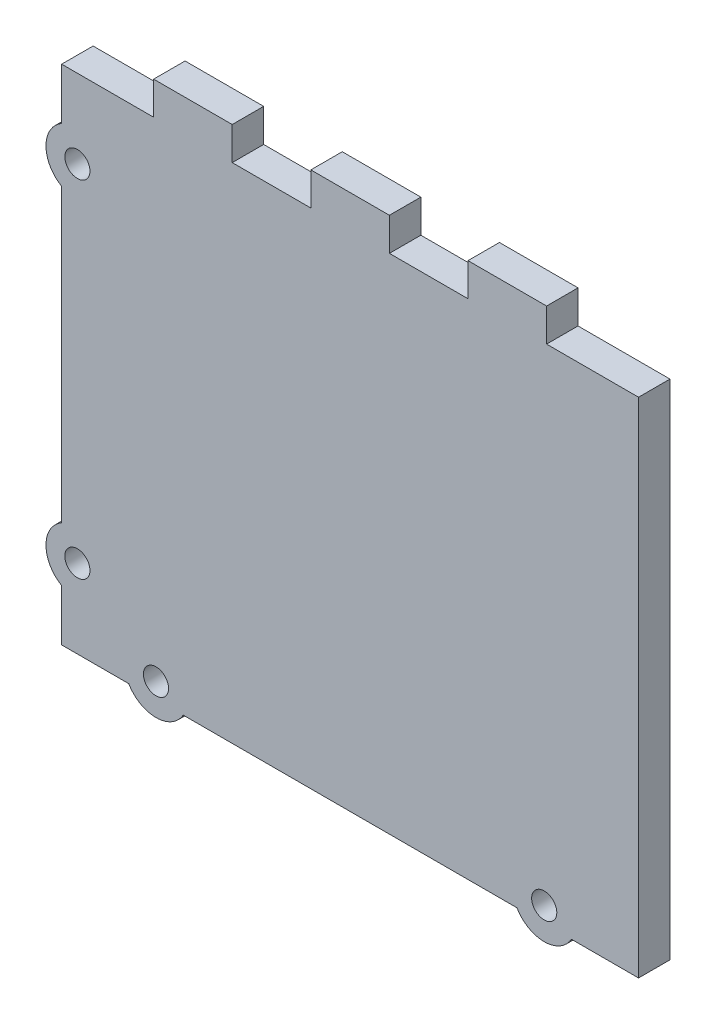
from build123d import *

# Parameters (mm, degrees)
SKETCH1_W             = 73.400000004
SKETCH1_H             = 64
BOSS_EXTRUDE1_DEPTH   = 4
BOSS_EXTRUDE2_DEPTH   = 4
SKETCH2_3_R           = 1.6
CUT_EXTRUDE1_DEPTH    = 4
BOSS_EXTRUDE3_DEPTH   = 4
SKETCH2_5_R           = 1.6
CUT_EXTRUDE2_DEPTH    = 4
SKETCH3_W             = 10
SKETCH3_H             = 4.5
BOSS_EXTRUDE4_DEPTH   = 4
BOSS_EXTRUDE4_2_DEPTH = 4
BOSS_EXTRUDE4_3_DEPTH = 4


with BuildPart() as part:
    # Sketch1 → Boss-Extrude1 (new body)
    with BuildSketch(Plane.XY):
        with Locations((0.200000002, -2.2)):
            Rectangle(SKETCH1_W, SKETCH1_H)
    extrude(amount=BOSS_EXTRUDE1_DEPTH)

    # Sketch2 → Boss-Extrude2 (add)
    with BuildSketch(Plane.XY.offset(4)):
        with BuildLine():
            ThreePointArc((21.433466103, -34.2), (24.9, -36.204218764), (28.366533897, -34.2))
            Line((28.366533897, -34.2), (21.433466103, -34.2))
        make_face()
    boss_extrude2 = extrude(amount=-BOSS_EXTRUDE2_DEPTH)

    # Sketch2<3> → Cut-Extrude1 (cut)
    with BuildSketch(Plane.XY.offset(4)):
        with Locations((24.9, -32.204218764)):
            Circle(SKETCH2_3_R)
    cut_extrude1 = extrude(amount=-CUT_EXTRUDE1_DEPTH, mode=Mode.SUBTRACT)

    # Mirror1: Boss-Extrude2, Cut-Extrude1 across plane
    add(boss_extrude2.mirror(Plane(origin=(0.200000002, 0, 0), x_dir=(0, 0, 1), z_dir=(1, 0, 0))))
    add(cut_extrude1.mirror(Plane(origin=(0.200000002, 0, 0), x_dir=(0, 0, 1), z_dir=(1, 0, 0))), mode=Mode.SUBTRACT)

    # Sketch2<4> → Boss-Extrude3 (add)
    with BuildSketch(Plane.XY.offset(4)):
        with BuildLine():
            ThreePointArc((-36.5, 23.264101615), (-38.5, 19.8), (-36.5, 16.335898385))
            Line((-36.5, 16.335898385), (-36.5, 23.264101615))
        make_face()
    boss_extrude3 = extrude(amount=-BOSS_EXTRUDE3_DEPTH)

    # Sketch2<5> → Cut-Extrude2 (cut)
    with BuildSketch(Plane.XY.offset(4)):
        with Locations((-34.5, 19.8)):
            Circle(SKETCH2_5_R)
    cut_extrude2 = extrude(amount=-CUT_EXTRUDE2_DEPTH, mode=Mode.SUBTRACT)

    # Mirror3: Boss-Extrude3, Cut-Extrude2 across plane
    add(boss_extrude3.mirror(Plane(origin=(0, -2.2, 0), x_dir=(0, 0, 1), z_dir=(0, -1, 0))))
    add(cut_extrude2.mirror(Plane(origin=(0, -2.2, 0), x_dir=(0, 0, 1), z_dir=(0, -1, 0))), mode=Mode.SUBTRACT)


with BuildPart() as body_2:
    # Sketch3 → Boss-Extrude4 (new body)
    with BuildSketch(Plane(origin=(0, 0, 0), x_dir=(-1, 0, 0), z_dir=(0, 0, -1))):
        with Locations((-20.200000004, 31.75)):
            Rectangle(SKETCH3_W, SKETCH3_H)
    extrude(amount=-BOSS_EXTRUDE4_DEPTH)


with BuildPart() as body_3:
    # Sketch3 → Boss-Extrude4 2 (new body)
    with BuildSketch(Plane(origin=(0, 0, 0), x_dir=(-1, 0, 0), z_dir=(0, 0, -1))):
        with Locations((-0.200000004, 31.75)):
            Rectangle(SKETCH3_W, SKETCH3_H)
    extrude(amount=-BOSS_EXTRUDE4_2_DEPTH)


with BuildPart() as body_4:
    # Sketch3 → Boss-Extrude4 3 (new body)
    with BuildSketch(Plane(origin=(0, 0, 0), x_dir=(-1, 0, 0), z_dir=(0, 0, -1))):
        with Locations((19.799999996, 31.75)):
            Rectangle(SKETCH3_W, SKETCH3_H)
    extrude(amount=-BOSS_EXTRUDE4_3_DEPTH)


with BuildPart() as body_2_1:
    add(body_2.part)

    # Combine1: union part, body 3, body 4
    add(part.part)
    add(body_3.part)
    add(body_4.part)


solid = body_2_1.part
